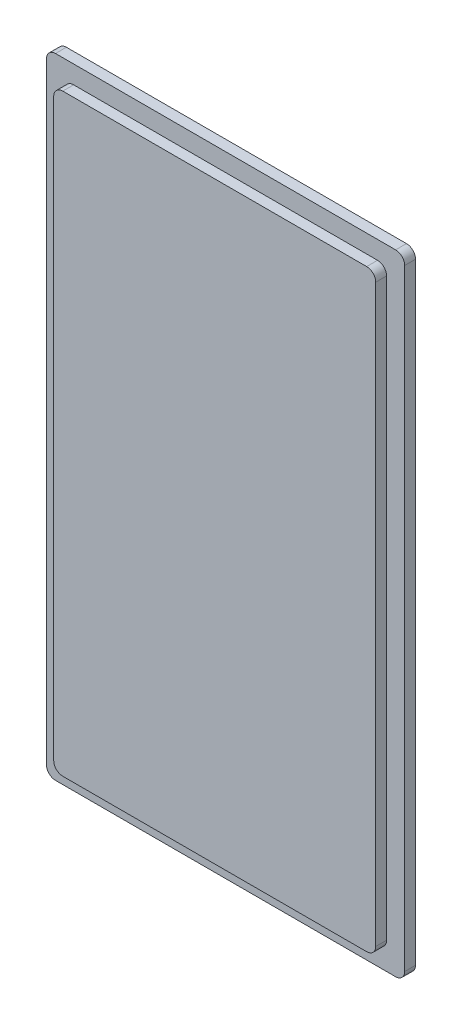
from build123d import *

# Parameters (mm, degrees)
BOSS_EXTRUDE1_DEPTH = 6
BOSS_EXTRUDE2_DEPTH = 6


with BuildPart() as part:
    # Sketch1 → Boss-Extrude1 (new body)
    with BuildSketch(Plane.XY):
        with BuildLine():
            Line((-60.314477407, 37.013930843), (-60.314477407, -300.986069157))
            ThreePointArc((-60.314477407, -300.986069157), (-58.850011313, -304.521603063), (-55.314477407, -305.986069157))
            Line((-55.314477407, -305.986069157), (132.685522593, -305.986069157))
            ThreePointArc((132.685522593, -305.986069157), (136.221056499, -304.521603063), (137.685522593, -300.986069157))
            Line((137.685522593, -300.986069157), (137.685522593, 37.013930843))
            ThreePointArc((137.685522593, 37.013930843), (136.221056499, 40.549464749), (132.685522593, 42.013930843))
            Line((132.685522593, 42.013930843), (-55.314477407, 42.013930843))
            ThreePointArc((-55.314477407, 42.013930843), (-58.850011313, 40.549464749), (-60.314477407, 37.013930843))
        make_face()
    extrude(amount=BOSS_EXTRUDE1_DEPTH)

    # Sketch2 → Boss-Extrude2 (add)
    with BuildSketch(Plane.XY.offset(6)):
        with BuildLine():
            Line((-50.314477407, 27.013930843), (-50.314477407, -290.986069157))
            ThreePointArc((-50.314477407, -290.986069157), (-48.850011313, -294.521603063), (-45.314477407, -295.986069157))
            Line((-45.314477407, -295.986069157), (122.685522593, -295.986069157))
            ThreePointArc((122.685522593, -295.986069157), (126.221056499, -294.521603063), (127.685522593, -290.986069157))
            Line((127.685522593, -290.986069157), (127.685522593, 27.013930843))
            ThreePointArc((127.685522593, 27.013930843), (126.221056499, 30.549464749), (122.685522593, 32.013930843))
            Line((122.685522593, 32.013930843), (-45.314477407, 32.013930843))
            ThreePointArc((-45.314477407, 32.013930843), (-48.850011313, 30.549464749), (-50.314477407, 27.013930843))
        make_face()
    extrude(amount=BOSS_EXTRUDE2_DEPTH)


solid = part.part
